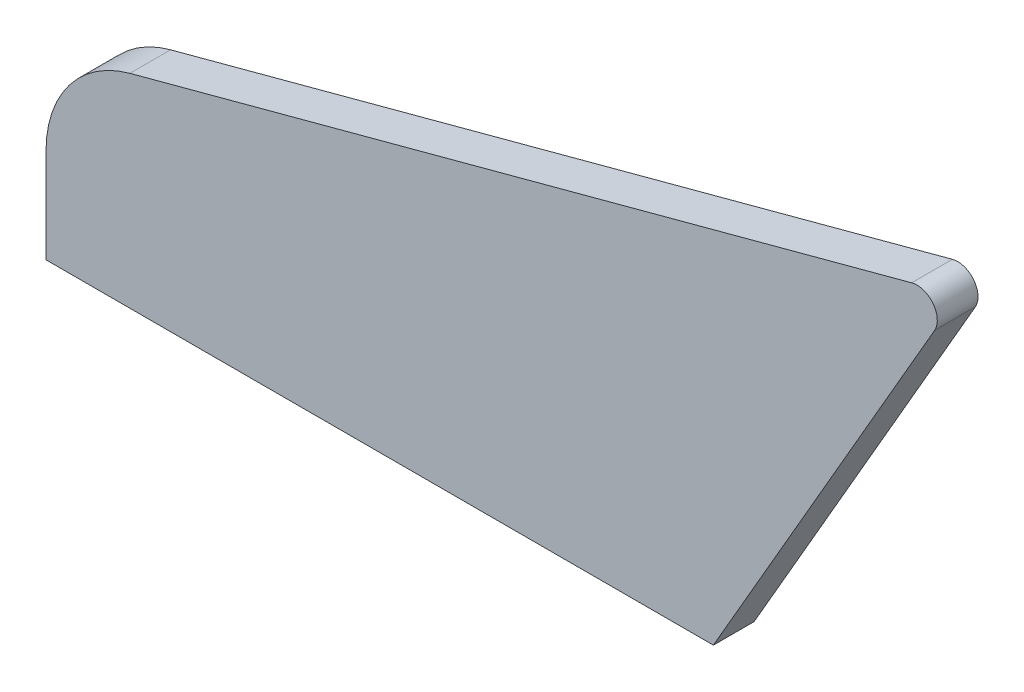
from build123d import *

# Parameters (mm, degrees)
BOSS_EXTRU_1_DEPTH = 18
CONG_1_R           = 50
CONG_2_R           = 9


with BuildPart() as part:
    # Esquisse1 → Boss.-Extru.1 (new body)
    with BuildSketch(Plane.XY):
        Polygon((0, 0), (295, 0), (403.62976321, 188.152269093), (0, 80), align=None)
    extrude(amount=BOSS_EXTRU_1_DEPTH)

    # Congé1
    cong_1_edges = [part.edges().sort_by_distance(p)[0] for p in [
        (0, 80, 9),
    ]]
    fillet(cong_1_edges, radius=CONG_1_R)

    # Congé2
    cong_2_edges = [part.edges().sort_by_distance(p)[0] for p in [
        (403.62976321, 188.152269093, 9),
    ]]
    fillet(cong_2_edges, radius=CONG_2_R)


solid = part.part
